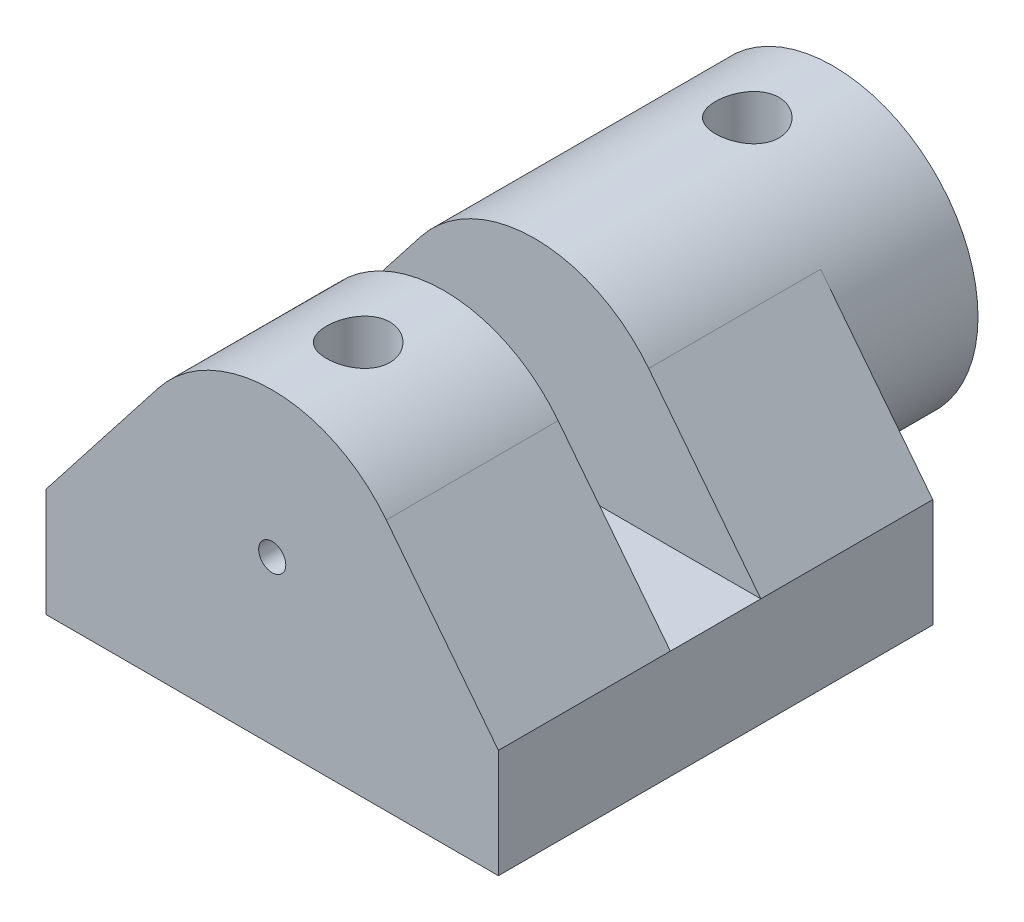
from build123d import *
from build123d.topology import SkipClean

# Parameters (mm, degrees)
SKETCH1_R           = 0.75
BOSS_EXTRUDE1_DEPTH = 24
BOSS_EXTRUDE2_START = 7
SKETCH2_R           = 8
SKETCH2_R_2         = 2.65
BOSS_EXTRUDE2_DEPTH = 7
SKETCH4_W           = 5
SKETCH4_H           = 11
CUT_EXTRUDE1_DEPTH  = 39.600518131
SKETCH5_R           = 1.75
CUT_EXTRUDE2_DEPTH  = 32.957002363
SKETCH6_R           = 1.75
CUT_EXTRUDE3_DEPTH  = 29.517538579


with BuildPart() as part:
    # Sketch1 → Boss-Extrude1 (new body)
    with BuildSketch(Plane.XY):
        with BuildLine():
            Line((-12.5, 0), (12.5, 0))
            Line((12.5, 0), (12.5, 6))
            Line((12.5, 6), (6.302543671, 13.927265294))
            ThreePointArc((6.302543671, 13.927265294), (0, 17), (-6.302543671, 13.927265294))
            Line((-6.302543671, 13.927265294), (-12.5, 6))
            Line((-12.5, 6), (-12.5, 0))
        make_face()
        with Locations((0, 9)):
            Circle(SKETCH1_R, mode=Mode.SUBTRACT)
    extrude(amount=BOSS_EXTRUDE1_DEPTH)

    # Sketch2 → Boss-Extrude2 (add)
    with SkipClean():  # the faces are left unmerged after this step: merging them gives an invalid solid
        with BuildSketch(Plane(origin=(0, 0, 0), x_dir=(-1, 0, 0), z_dir=(0, 0, -1)).offset(BOSS_EXTRUDE2_START)):
            with Locations((0, 9)):
                Circle(SKETCH2_R)
            with Locations((0, 9)):
                Circle(SKETCH2_R_2, mode=Mode.SUBTRACT)
        extrude(amount=-BOSS_EXTRUDE2_DEPTH)

    # Sketch4 → Cut-Extrude1 (cut, through all)
    with BuildSketch(Plane(origin=(12.5, 0, 0), x_dir=(0, 0, -1), z_dir=(1, 0, 0))):
        with Locations((-12, 11.5)):
            Rectangle(SKETCH4_W, SKETCH4_H)
    extrude(amount=-CUT_EXTRUDE1_DEPTH, mode=Mode.SUBTRACT)

    # Sketch5 → Cut-Extrude2 (cut, through all)
    with SkipClean():  # the faces are left unmerged after this step: merging them gives an invalid solid
        with BuildSketch(Plane.XZ):
            with Locations(Location((0, 19.25, 0), (0, 0, 270))):
                Circle(SKETCH5_R)
        extrude(amount=-CUT_EXTRUDE2_DEPTH, mode=Mode.SUBTRACT)

    # Sketch6 → Cut-Extrude3 (cut, through all)
    with SkipClean():  # the faces are left unmerged after this step: merging them gives an invalid solid
        with BuildSketch(Plane(origin=(0, 9, 0), x_dir=(-1, 0, 0), z_dir=(0, -1, 0))):
            with Locations(Location((0, 2.25, 0), (0, 0, 90))):
                Circle(SKETCH6_R)
        extrude(amount=-CUT_EXTRUDE3_DEPTH, mode=Mode.SUBTRACT)


solid = part.part
